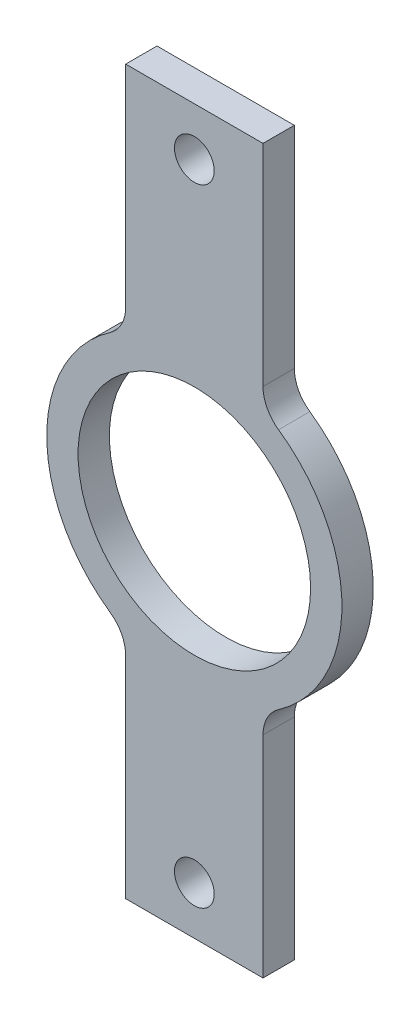
from build123d import *

# Parameters (mm, degrees)
SKETCH_1_R      = 9.65
SKETCH_1_R_2    = 1.65
EXTRUDE_1_DEPTH = 2.6
FILLET_1_R      = 3


with BuildPart() as part:
    # 草图1 → 凸台-拉伸1 (new body)
    with BuildSketch(Plane.XY):
        with BuildLine():
            Line((0, 30), (-5.7, 30))
            Line((-5.7, 30), (-5.7, 10.843085354))
            ThreePointArc((-5.7, 10.843085354), (-12.25, 0), (-5.7, -10.843085354))
            Line((-5.7, -10.843085354), (-5.7, -30))
            Line((-5.7, -30), (0, -30))
            Line((0, -30), (5.7, -30))
            Line((5.7, -30), (5.7, -10.843085354))
            ThreePointArc((5.7, -10.843085354), (12.25, 0), (5.7, 10.843085354))
            Line((5.7, 10.843085354), (5.7, 30))
            Line((5.7, 30), (0, 30))
        make_face()
        Circle(SKETCH_1_R, mode=Mode.SUBTRACT)
        with Locations((0, 26)):
            Circle(SKETCH_1_R_2, mode=Mode.SUBTRACT)
        with Locations((0, -26)):
            Circle(SKETCH_1_R_2, mode=Mode.SUBTRACT)
    extrude(amount=EXTRUDE_1_DEPTH)

    # 圆角1
    fillet_1_edges = [part.edges().sort_by_distance(p)[0] for p in [
        (5.7, -10.843085354, 1.3),
        (-5.7, -10.843085354, 1.3),
        (-5.7, 10.843085354, 1.3),
        (5.7, 10.843085354, 1.3),
    ]]
    fillet(fillet_1_edges, radius=FILLET_1_R)


solid = part.part
